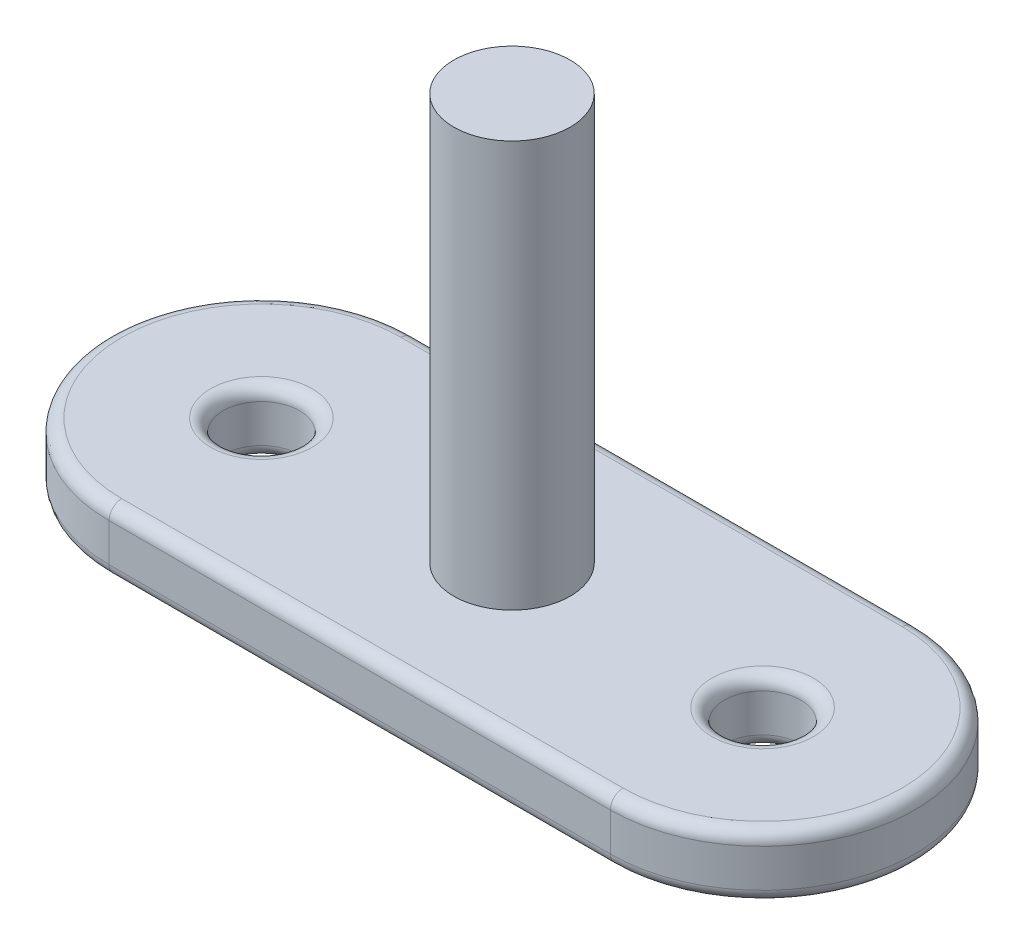
from build123d import *

# Parameters (mm, degrees)
SKETCH1_R           = 1.5
BOSS_EXTRUDE1_DEPTH = 2.5
FILLET1_R           = 0.5
SKETCH2_R           = 2.29148448
BOSS_EXTRUDE2_DEPTH = 16


with BuildPart() as part:
    # Sketch1 → Boss-Extrude1 (new body)
    with BuildSketch(Plane(origin=(0, 0, 0), x_dir=(1, 0, 0), z_dir=(0, 1, 0))):
        with BuildLine():
            Line((-9.87, 6), (9.87, 6))
            ThreePointArc((9.87, 6), (15.87, 0), (9.87, -6))
            Line((9.87, -6), (-9.87, -6))
            ThreePointArc((-9.87, -6), (-15.87, 0), (-9.87, 6))
        make_face()
        with Locations(Location((-9.87, 0, 0), (0, 0, 270))):
            Circle(SKETCH1_R, mode=Mode.SUBTRACT)
        with Locations(Location((9.87, 0, 0), (0, 0, 270))):
            Circle(SKETCH1_R, mode=Mode.SUBTRACT)
    extrude(amount=BOSS_EXTRUDE1_DEPTH)

    # Fillet1
    fillet1_edges = [part.edges().sort_by_distance(p)[0] for p in [
        (-9.87, 0, -1.5),
        (-9.87, 2.5, -1.5),
        (15.87, 2.5, 0),
        (9.87, 0, -1.5),
        (9.87, 2.5, -1.5),
        (0, 2.5, -6),
        (-15.87, 2.5, 0),
        (0, 0, -6),
        (15.87, 0, 0),
        (0, 0, 6),
        (-15.87, 0, 0),
        (0, 2.5, 6),
    ]]
    fillet(fillet1_edges, radius=FILLET1_R)

    # Sketch2 → Boss-Extrude2 (add)
    with BuildSketch(Plane(origin=(0, 2.5, 0), x_dir=(1, 0, 0), z_dir=(0, 1, 0))):
        with Locations(Location((0, 0, 0), (0, 0, 270))):
            Circle(SKETCH2_R)
    extrude(amount=BOSS_EXTRUDE2_DEPTH)


solid = part.part
